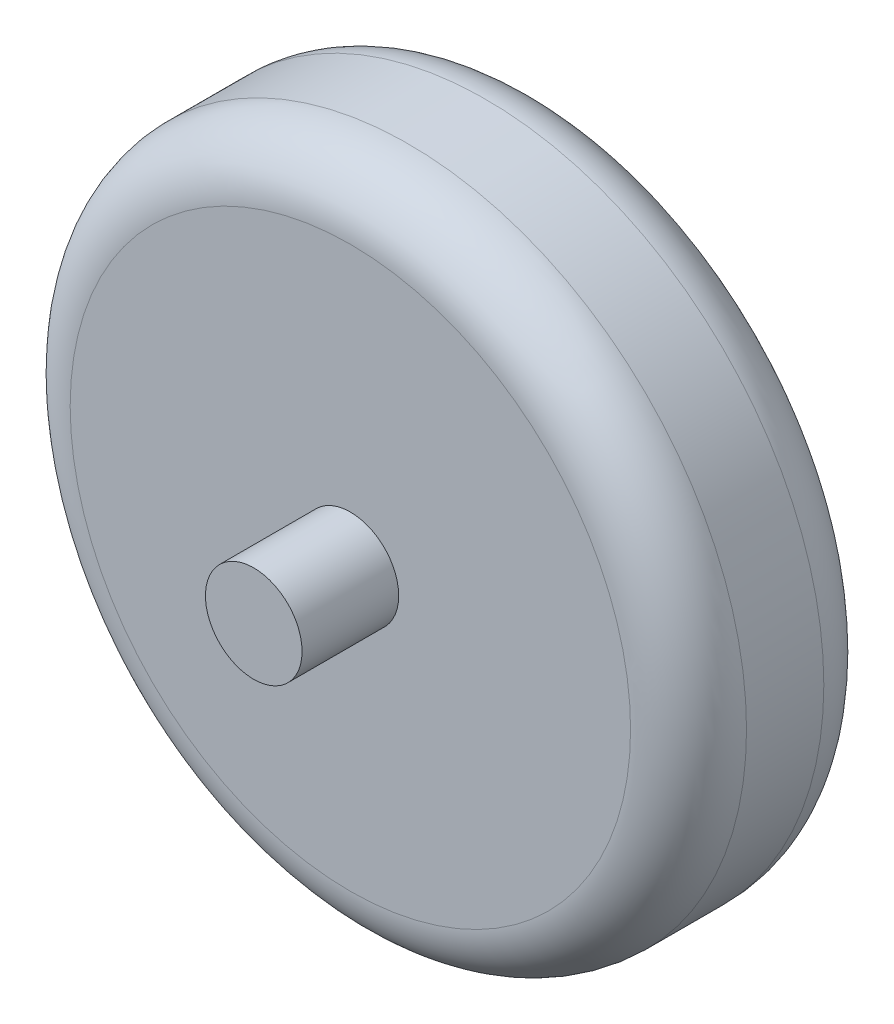
from build123d import *

# Parameters (mm, degrees)
SKETCH1_R           = 17.5
BOSS_EXTRUDE1_DEPTH = 5
FILLET1_R           = 3
SKETCH2_R           = 2.5
BOSS_EXTRUDE2_DEPTH = 10


with BuildPart() as part:
    # Sketch1 → Boss-Extrude1 (new, symmetric)
    with BuildSketch(Plane.XY):
        Circle(SKETCH1_R)
    extrude(amount=BOSS_EXTRUDE1_DEPTH, both=True)

    # Fillet1
    fillet1_edges = [part.edges().sort_by_distance(p)[0] for p in [
        (-17.5, 0, -5),
        (-17.5, 0, 5),
    ]]
    fillet(fillet1_edges, radius=FILLET1_R)

    # Sketch2 → Boss-Extrude2 (add, symmetric)
    with BuildSketch(Plane.XY):
        Circle(SKETCH2_R)
    extrude(amount=BOSS_EXTRUDE2_DEPTH, both=True)


solid = part.part
